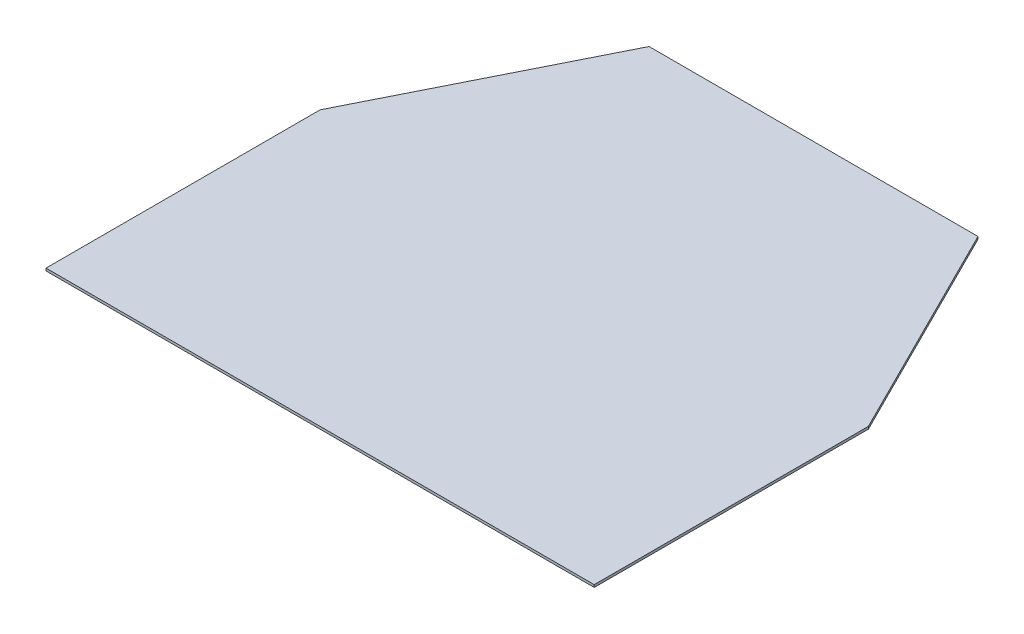
from build123d import *

# Parameters (mm, degrees)
SKETCH2_W           = 508
SKETCH2_H           = 457.2
BOSS_EXTRUDE1_DEPTH = 2.286
CHAMFER1_SIZE       = 203.2
CHAMFER1_SIZE2      = 101.6
CHAMFER2_SIZE       = 101.6
CHAMFER2_SIZE2      = 203.2


with BuildPart() as part:
    # Sketch2 → Boss-Extrude1 (new body)
    with BuildSketch(Plane(origin=(0, 0, 0), x_dir=(1, 0, 0), z_dir=(0, 1, 0))):
        Rectangle(SKETCH2_W, SKETCH2_H)
    extrude(amount=BOSS_EXTRUDE1_DEPTH)

    # Chamfer1
    chamfer1_edges = [part.edges().sort_by_distance(p)[0] for p in [
        (254, 1.143, -228.6),
    ]]
    chamfer1_side = [part.faces().sort_by_distance(p)[0] for p in [
        (254, 1.143, 0),
    ]]
    chamfer(chamfer1_edges, length=CHAMFER1_SIZE, length2=CHAMFER1_SIZE2, reference=chamfer1_side[0])

    # Chamfer2
    chamfer2_edges = [part.edges().sort_by_distance(p)[0] for p in [
        (-254, 1.143, -228.6),
    ]]
    chamfer2_side = [part.faces().sort_by_distance(p)[0] for p in [
        (-50.8, 1.143, -228.6),
    ]]
    chamfer(chamfer2_edges, length=CHAMFER2_SIZE, length2=CHAMFER2_SIZE2, reference=chamfer2_side[0])


solid = part.part
